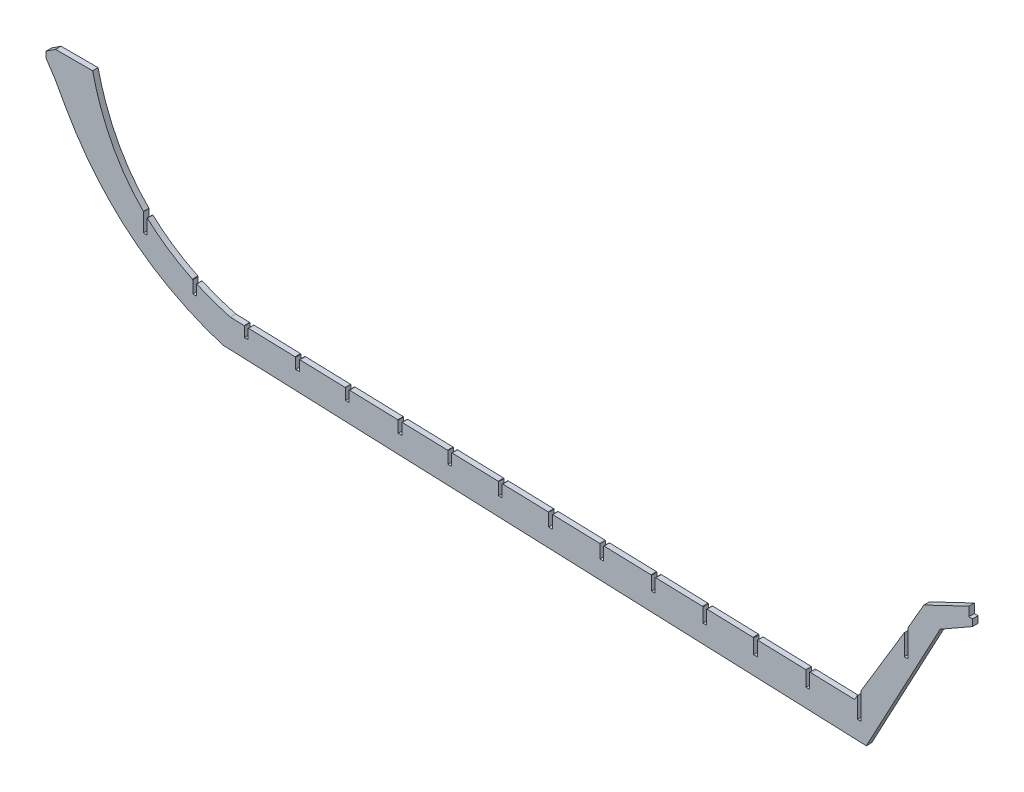
from build123d import *

# Parameters (mm, degrees)
BOSS_EXTRU_2_DEPTH      = 9
ENL_V_MAT_EXTRU_2_DEPTH = 9
ENL_V_MAT_EXTRU_3_DEPTH = 10


with BuildPart() as part:
    # Esquisse2 → Boss.-Extru.2 (new body)
    with BuildSketch(Plane.XY):
        with BuildLine():
            Line((0, 0), (-1054.629910096, 41.504522095))
            add(Edge.make_bspline(
                [(-1054.629910096, 41.504522095), (-1224.898895692, 94.973668649), (-1312.524127552, 251.32222999)],
                knots=[0, 0, 0, 1, 1, 1], degree=2))
            Line((-1312.524127552, 251.32222999), (-1328.531696794, 280.319102935))
            Line((-1328.531696794, 280.319102935), (-1344.106951464, 303.85903019))
            Line((-1344.106951464, 303.85903019), (-1344.106951464, 313.726103663))
            Line((-1344.106951464, 313.726103663), (-1328.531696794, 324.031511808))
            Line((-1328.531696794, 324.031511808), (-1267.786373333, 324.031511808))
            add(Edge.make_bspline(
                [(-1267.786373333, 324.031511808), (-1224.243578326, 137.104736819), (-1042.241095265, 87.273554015)],
                knots=[0, 0, 0, 1, 1, 1], degree=2))
            Line((-1042.241095265, 87.273554015), (-19.342578419, 56.128666857))
            Line((-19.342578419, 56.128666857), (68.330488592, 201.78734955))
            Line((68.330488592, 201.78734955), (94.343817504, 246.973731483))
            Line((94.343817504, 246.973731483), (174.034427263, 285.060674799))
            Line((174.034427263, 285.060674799), (174.034427263, 256.206685378))
            Line((174.034427263, 256.206685378), (121.088242371, 225.986251341))
            Line((121.088242371, 225.986251341), (0, 0))
        make_face()
    extrude(amount=BOSS_EXTRU_2_DEPTH)

    # Esquisse4 → Enlèv. mat.-Extru.2 (cut)
    with BuildSketch(Plane.XY.offset(9)):
        Polygon((-1184.529602798, 165.625257232), (-1184.529602798, 135.448257781), (-1178.529602798, 135.448257781), (-1178.529602798, 159.848193824), (-1148.778615176, 162.133206692), (-1103.644457427, 109.431746416), (-1103.644457427, 89.382882562), (-1097.644457427, 89.382882562), (-1097.644457427, 106.656259625), (-1065.473536438, 118.031821421), (-1019.010707999, 86.291101209), (-1019.010707999, 69.825141164), (-1013.010707999, 69.825141164), (-1013.010707999, 86.108415126), (-968.986122001, 94.715454809), (-935.048554391, 83.734648387), (-935.048554391, 66.613746424), (-929.048554391, 66.613746424), (-929.048554391, 83.551962304), (-895.961109624, 92.314776132), (-853.677357938, 81.257084201), (-853.677357938, 63.31851584), (-847.677357938, 63.31851584), (-847.677357938, 81.074398118), (-802.198540596, 93.509303435), (-767.007980127, 78.618202682), (-767.007980127, 59.907678473), (-761.007980127, 59.907678473), (-761.007980127, 78.435516599), (-715.422898508, 88.814577228), (-685.459139962, 76.135229657), (-685.459139962, 56.698357737), (-679.459139962, 56.698357737), (-679.459139962, 75.952543574), (-642.529169259, 90.533708307), (-602.536147946, 73.610416895), (-602.536147946, 53.434957827), (-596.536147946, 53.434957827), (-596.536147946, 73.427730812), (-554.228753776, 85.390518635), (-520.486290487, 71.112189055), (-520.486290487, 50.205919764), (-514.486290487, 50.205919764), (-514.486290487, 70.929502973), (-485.818778234, 81.469195532), (-436.427460908, 68.552792675), (-436.427460908, 46.897819438), (-430.427460908, 46.897819438), (-430.427460908, 68.370106592), (-395.80060759, 80.200914059), (-351.840812464, 65.977325434), (-351.840812464, 43.56894702), (-345.840812464, 43.56894702), (-345.840812464, 65.794639351), (-303.137940146, 78.435516599), (-267.638115004, 63.41354861), (-267.638115004, 40.255184833), (-261.638115004, 40.255184833), (-261.638115004, 63.230862527), (-216.692202472, 71.261315551), (-184.626054736, 60.886023927), (-184.626054736, 36.988279678), (-178.626054736, 36.988279678), (-178.626054736, 60.703337844), (-152.318805778, 72.265594394), (-98.813045081, 58.273216832), (-98.813045081, 33.611144324), (-92.813045081, 33.611144324), (-92.813045081, 58.090530749), (-14.555231491, 64.274536633), (-14.555231491, 30.295213064), (-8.555231491, 30.295213064), (-8.555231491, 74.242844187), (19.143152313, 159.848193824), (62.357322712, 191.863623789), (62.357322712, 157.574856228), (68.357322712, 157.574856228), (68.357322712, 201.831931343), (-1172.693052787, 202.207608368), align=None)
    extrude(amount=-ENL_V_MAT_EXTRU_2_DEPTH, mode=Mode.SUBTRACT)

    # Esquisse5 → Enlèv. mat.-Extru.3 (cut)
    with BuildSketch(Plane.XY.offset(9)):
        Polygon((168.034427263, 282.193063915), (168.034427263, 267.193063915), (174.034427263, 267.193063915), (199.390837842, 261.800934677), (195.304614358, 289.974370277), (176.522323958, 289.61592962), align=None)
    extrude(amount=-ENL_V_MAT_EXTRU_3_DEPTH, mode=Mode.SUBTRACT)


solid = part.part
